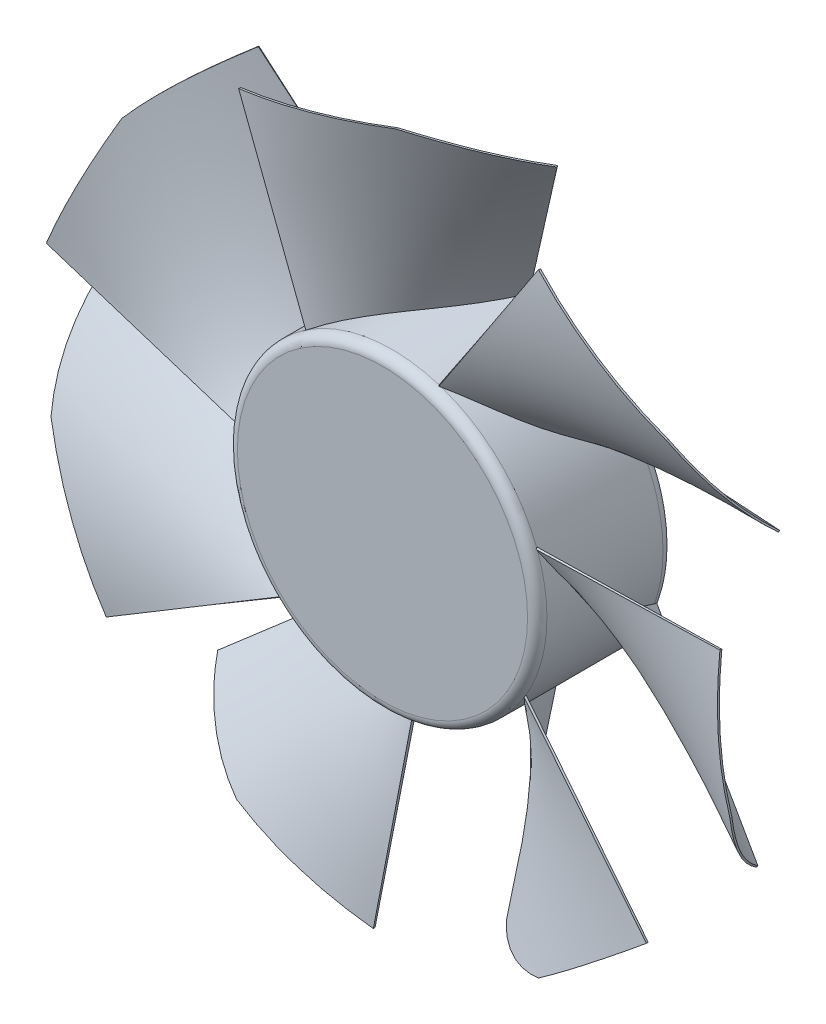
from build123d import *

# Parameters (mm, degrees)
SKETCH_1_R               = 16
EXTRUDE_1_DEPTH          = 14
FILLET_1_R               = 1
PATTERN_CIRCULAR_1_COUNT = 7
SKETCH_4_OUTSIDE_W       = 103.383
SKETCH_4_OUTSIDE_H       = 103.762
SKETCH_4_OUTSIDE_R       = 36
CUT_EXTRUDE_2_DEPTH      = 14


with BuildPart() as part:
    # Эскиз1 → Вытянуть1 (new body)
    with BuildSketch(Plane.XY):
        Circle(SKETCH_1_R)
    extrude(amount=EXTRUDE_1_DEPTH)

    # Скругление1
    fillet_1_edges = [part.edges().sort_by_distance(p)[0] for p in [
        (-16, 0, 0),
        (-16, 0, 14),
    ]]
    fillet(fillet_1_edges, radius=FILLET_1_R)

    # Эскиз3 for По сечениям1 → По сечениям1 section 0
    with BuildSketch(Plane(origin=(35, 0, 0), x_dir=(0, 0, -1), z_dir=(1, 0, 0))):
        with BuildLine():
            Line((-13.919153243, 7.120780395), (-14.118006289, 7.142168854))
            # circular arc as an exact rational Bezier (weights 1, cos(half-angle), 1)
            Bezier((-14.118006289, 7.142168854), (-15.741854656, -7.955094233), (-7.912841666, -20.965505135), weights=[1, 0.947833795, 1])
            Line((-7.912841666, -20.965505135), (-7.741475517, -20.862385578))
            Bezier((-7.741475517, -20.862385578), (-15.535808481, -7.90960664), (-13.919153243, 7.120780395), weights=[1, 0.947833795, 1])
        make_face()
    # Эскиз2 for По сечениям1 → По сечениям1 section 1
    with BuildSketch(Plane(origin=(13, 0, 0), x_dir=(0, 0, -1), z_dir=(1, 0, 0))):
        with BuildLine():
            Line((-0.065040299, -3.860928605), (0, -3.671799655))
            Bezier((0, -3.671799655), (-7.825255184, -0.980741857), (-12.840925328, 5.601010476), weights=[1, 0.957034642, 1])
            Line((-12.840925328, 5.601010476), (-13, 5.479786515))
            Bezier((-13, 5.479786515), (-7.947599996, -1.150164132), (-0.065040299, -3.860928605), weights=[1, 0.957034642, 1])
        make_face()
    loft_1 = loft()

    # Круговой массив1: По сечениям1 ×7 about axis
    pattern_circular_1_axis = Axis((0, 0, 13), (0, 0, -1))
    for i in range(1, PATTERN_CIRCULAR_1_COUNT):
        add(loft_1.rotate(pattern_circular_1_axis, i * 360 / PATTERN_CIRCULAR_1_COUNT))

    # Эскиз4 outside → Вырез-Вытянуть2 (cut)
    with BuildSketch(Plane.XY):
        with Locations((-1.2085, -0.824)):
            Rectangle(SKETCH_4_OUTSIDE_W, SKETCH_4_OUTSIDE_H)
        Circle(SKETCH_4_OUTSIDE_R, mode=Mode.SUBTRACT)
    extrude(amount=CUT_EXTRUDE_2_DEPTH, mode=Mode.SUBTRACT)


solid = part.part
